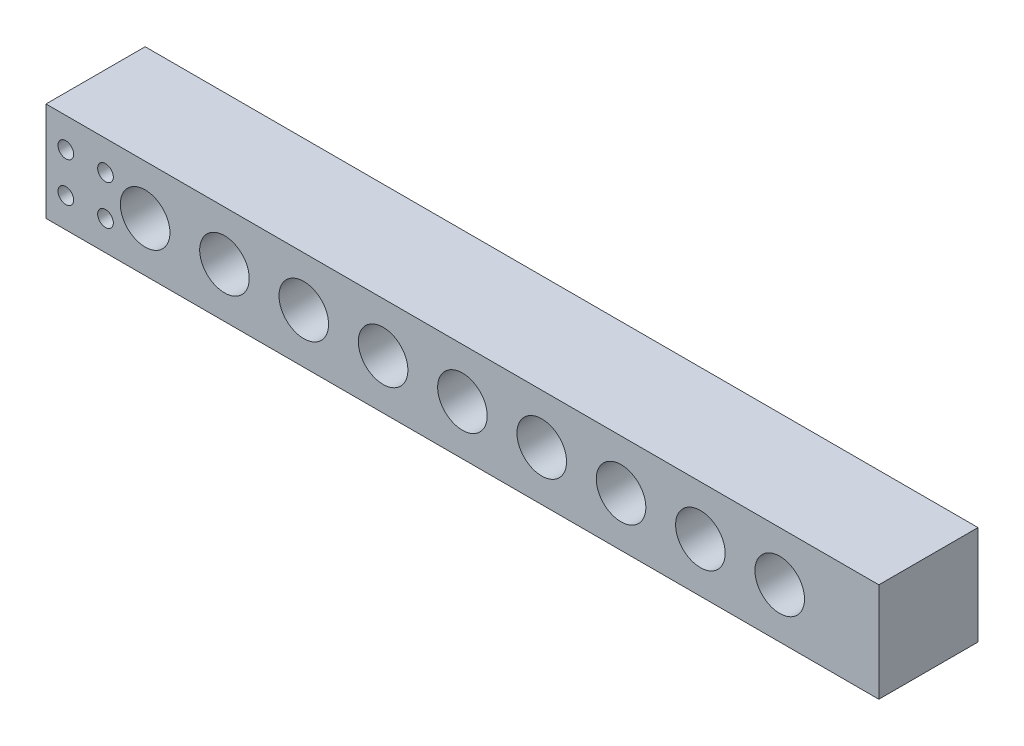
from build123d import *

# Parameters (mm, degrees)
SKETCH1_W           = 266.7
SKETCH1_H           = 31.75
BOSS_EXTRUDE1_DEPTH = 31.75
SKETCH2_R           = 7.9375
CUT_EXTRUDE1_DEPTH  = 31.75
LPATTERN1_COUNT     = 9
LPATTERN1_PITCH     = 25.4
SKETCH3_R           = 2.50825
CUT_EXTRUDE2_DEPTH  = 31.75


with BuildPart() as part:
    # Sketch1 → Boss-Extrude1 (new body)
    with BuildSketch(Plane.XY):
        with Locations((-133.35, -15.875)):
            Rectangle(SKETCH1_W, SKETCH1_H)
    extrude(amount=BOSS_EXTRUDE1_DEPTH)

    # Sketch2 → Cut-Extrude1 (cut)
    with BuildSketch(Plane.XY.offset(31.75)):
        with Locations((-234.95, -15.875)):
            Circle(SKETCH2_R)
    cut_extrude1 = extrude(amount=-CUT_EXTRUDE1_DEPTH, mode=Mode.SUBTRACT)

    # LPattern1: Cut-Extrude1 ×9
    with Locations(*[(i * LPATTERN1_PITCH, 0, 0) for i in range(1, LPATTERN1_COUNT)]):
        add(cut_extrude1, mode=Mode.SUBTRACT)

    # Sketch3 → Cut-Extrude2 (cut)
    with BuildSketch(Plane.XY.offset(31.75)):
        with Locations((-260.35, -9.525)):
            Circle(SKETCH3_R)
        with Locations((-247.65, -9.525)):
            Circle(SKETCH3_R)
        with Locations((-260.35, -22.225)):
            Circle(SKETCH3_R)
        with Locations((-247.65, -22.225)):
            Circle(SKETCH3_R)
    extrude(amount=-CUT_EXTRUDE2_DEPTH, mode=Mode.SUBTRACT)


solid = part.part
